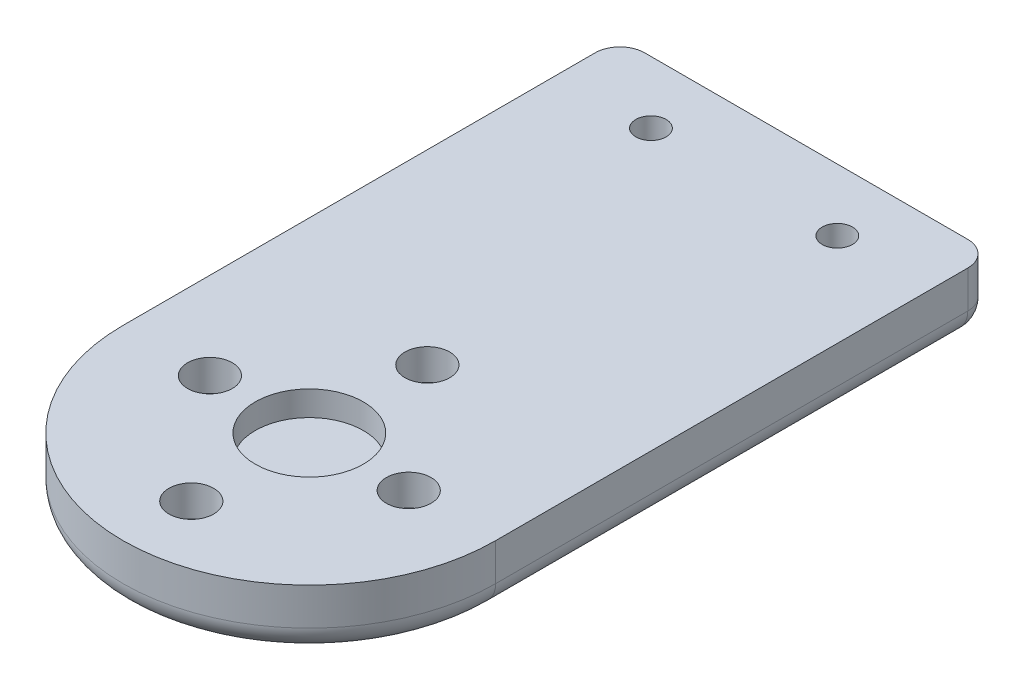
from build123d import *

# Parameters (mm, degrees)
BOSS_EXTRUDE1_DEPTH                                 = 5
SKETCH2_R                                           = 0.5
CUT_EXTRUDE1_DEPTH                                  = 44.011626335
CBORE_FOR_2_BINDING_HEAD_MACHINE_SCREW1_D           = 2.4384
CBORE_FOR_2_BINDING_HEAD_MACHINE_SCREW1_CBORE_D     = 5.55752
CBORE_FOR_2_BINDING_HEAD_MACHINE_SCREW1_CBORE_DEPTH = 2.499995
FILLET1_R                                           = 2
SKETCH6_R                                           = 4.35
CUT_EXTRUDE2_DEPTH                                  = 2
CBORE_FOR_M3_SBHCS1_D                               = 3.6
CBORE_FOR_M3_SBHCS1_CBORE_D                         = 6.7
CBORE_FOR_M3_SBHCS1_CBORE_DEPTH                     = 2.5


with BuildPart() as part:
    # Sketch1 → Boss-Extrude1 (new body)
    with BuildSketch(Plane(origin=(0, 0, 0), x_dir=(1, 0, 0), z_dir=(0, 1, 0))):
        with BuildLine():
            Line((-15, 0), (-15, 40))
            Line((-15, 40), (15, 40))
            Line((15, 40), (15, 0))
            ThreePointArc((15, 0), (0, -15), (-15, 0))
        make_face()
    extrude(amount=BOSS_EXTRUDE1_DEPTH)

    # Sketch2 → Cut-Extrude1 (cut, through all)
    with BuildSketch(Plane(origin=(0, 5, 0), x_dir=(1, 0, 0), z_dir=(0, 1, 0))):
        with Locations(Location((-8, 0, 0), (0, 0, 270))):
            Circle(SKETCH2_R)
        with Locations(Location((0, 9.5, 0), (0, 0, 270))):
            Circle(SKETCH2_R)
        with Locations(Location((8, 0, 0), (0, 0, 270))):
            Circle(SKETCH2_R)
        with Locations(Location((0, -9.5, 0), (0, 0, 270))):
            Circle(SKETCH2_R)
    extrude(amount=-CUT_EXTRUDE1_DEPTH, mode=Mode.SUBTRACT)

    # CBORE for #2 Binding Head Machine Screw1 (through all)
    with Locations(Plane(origin=(0, 0, 0), x_dir=(-1, 0, 0), z_dir=(0, -1, 0))):
        with Locations((-7.5, 35), (7.5, 35)):
            CounterBoreHole(CBORE_FOR_2_BINDING_HEAD_MACHINE_SCREW1_D / 2, CBORE_FOR_2_BINDING_HEAD_MACHINE_SCREW1_CBORE_D / 2, CBORE_FOR_2_BINDING_HEAD_MACHINE_SCREW1_CBORE_DEPTH)

    # Fillet1
    fillet1_edges = [part.edges().sort_by_distance(p)[0] for p in [
        (-15, 0, -20),
        (0, 0, -40),
        (15, 0, -20),
        (0, 0, 15),
        (-15, 2.5, -40),
        (15, 2.5, -40),
    ]]
    fillet(fillet1_edges, radius=FILLET1_R)

    # Sketch6 → Cut-Extrude2 (cut)
    with BuildSketch(Plane(origin=(0, 5, 0), x_dir=(1, 0, 0), z_dir=(0, 1, 0))):
        with Locations(Location((0, 0, 0), (0, 0, 270))):
            Circle(SKETCH6_R)
    extrude(amount=-CUT_EXTRUDE2_DEPTH, mode=Mode.SUBTRACT)

    # CBORE for M3 SBHCS1 (through all)
    with Locations(Plane(origin=(0, 0, 0), x_dir=(-1, 0, 0), z_dir=(0, -1, 0))):
        with Locations((0, 9.5), (8, 0), (0, -9.5), (-8, 0)):
            CounterBoreHole(CBORE_FOR_M3_SBHCS1_D / 2, CBORE_FOR_M3_SBHCS1_CBORE_D / 2, CBORE_FOR_M3_SBHCS1_CBORE_DEPTH)


solid = part.part
